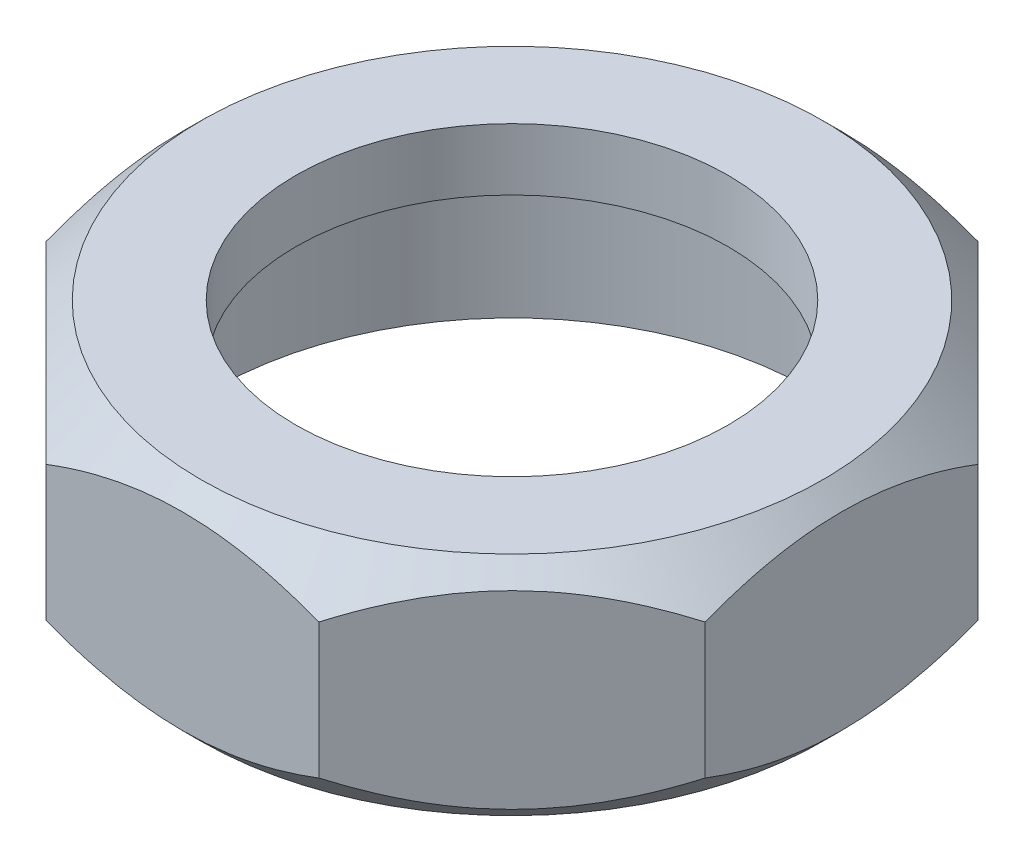
from build123d import *

# Parameters (mm, degrees)
SKETCH1_R           = 10.5
BOSS_EXTRUDE1_DEPTH = 5.5
SKETCH3_R           = 14.5
CUT_EXTRUDE1_DEPTH  = 8


with BuildPart() as part:
    # Sketch1 → Boss-Extrude1 (new, symmetric)
    with BuildSketch(Plane(origin=(0, 0, 0), x_dir=(1, 0, 0), z_dir=(0, 1, 0))):
        Polygon((6.627416998, 16), (-6.627416998, 16), (-16, 6.627416998), (-16, -6.627416998), (-6.627416998, -16), (6.627416998, -16), (16, -6.627416998), (16, 6.627416998), align=None)
        with Locations(Location((0, 0, 0), (0, 0, 270))):
            Circle(SKETCH1_R, mode=Mode.SUBTRACT)
    extrude(amount=BOSS_EXTRUDE1_DEPTH, both=True)

    # Sketch2 → Cut-Revolve1 (revolve, cut)
    with BuildSketch(Plane.XY, mode=Mode.PRIVATE) as cut_revolve1_sk:
        Polygon((-18.5, 2.1), (-18.5, 7.5), (-13.1, 7.5), align=None)
        Polygon((-13.1, -7.5), (-18.5, -2.1), (-18.5, -7.5), align=None)
    revolve(cut_revolve1_sk.sketch.rotate(Axis((0, 0, 0), (0, 1, 0)), 90), axis=Axis((0, 0, 0), (0, 1, 0)), mode=Mode.SUBTRACT)

    # Sketch3 → Cut-Extrude1 (cut)
    with BuildSketch(Plane.XZ.offset(5.5)):
        with Locations(Location((0, 0, 0), (0, 0, 270))):
            Circle(SKETCH3_R)
    extrude(amount=-CUT_EXTRUDE1_DEPTH, mode=Mode.SUBTRACT)


solid = part.part
